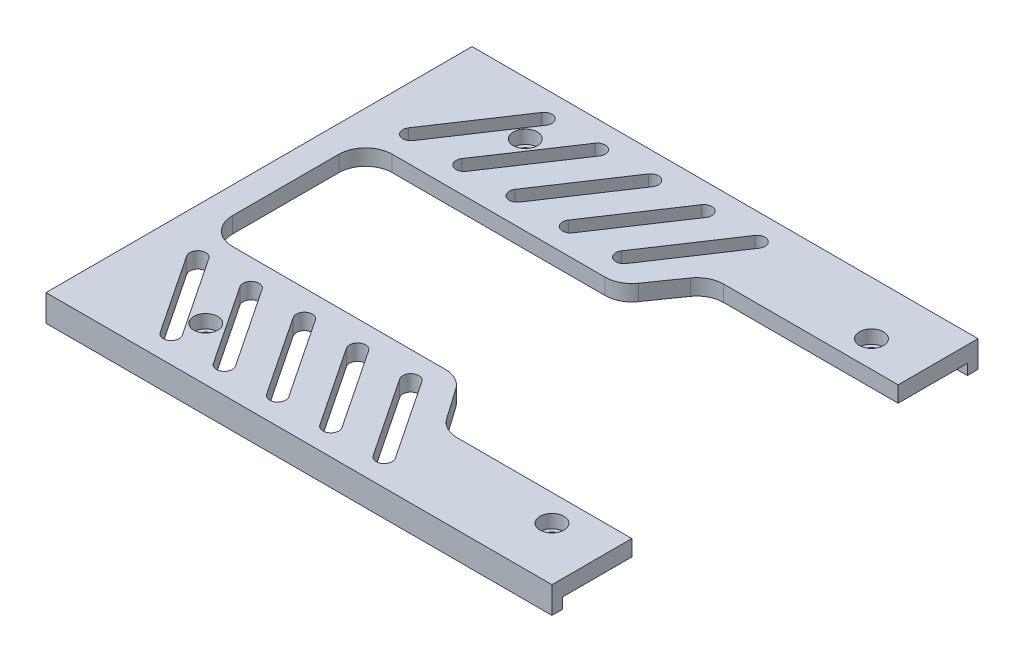
from build123d import *

# Parameters (mm, degrees)
SKETCH1_W           = 190
SKETCH1_H           = 160
BOSS_EXTRUDE1_DEPTH = 6
CUT_EXTRUDE1_DEPTH  = 10
SKETCH3_W           = 185
SKETCH3_H           = 4
SKETCH3_W_2         = 5
SKETCH3_H_2         = 152
BOSS_EXTRUDE3_DEPTH = 4
SKETCH4_R           = 4.5
CUT_EXTRUDE2_DEPTH  = 5
SKETCH5_R           = 3
CUT_EXTRUDE7_DEPTH  = 5


with BuildPart() as part:
    # Sketch1 → Boss-Extrude1 (new body)
    with BuildSketch(Plane(origin=(0, 0, 0), x_dir=(1, 0, 0), z_dir=(0, 1, 0))):
        with Locations((95, 80)):
            Rectangle(SKETCH1_W, SKETCH1_H)
    extrude(amount=BOSS_EXTRUDE1_DEPTH)

    # Sketch2 → Cut-Extrude1 (cut)
    with BuildSketch(Plane(origin=(0, 6, 0), x_dir=(1, 0, 0), z_dir=(0, 1, 0))):
        with BuildLine():
            ThreePointArc((34.503849117, 8.335899411), (38.664100589, 7.503849117), (39.496150883, 11.664100589))
            Line((39.496150883, 11.664100589), (20.605551275, 40))
            Line((20.605551275, 40), (19.496150883, 41.664100589))
            ThreePointArc((19.496150883, 41.664100589), (15.335899411, 42.496150883), (14.503849117, 38.335899411))
            Line((14.503849117, 38.335899411), (34.503849117, 8.335899411))
        make_face()
        with BuildLine():
            Line((10, 100), (10, 60))
            ThreePointArc((10, 60), (12.928932188, 52.928932188), (20, 50))
            Line((20, 50), (100, 50))
            ThreePointArc((100, 50), (104.617486132, 48.870108332), (108.191520443, 45.735764364))
            Line((108.191520443, 45.735764364), (116.223971332, 34.264235636))
            ThreePointArc((116.223971332, 34.264235636), (119.798005643, 31.129891668), (124.415491775, 30))
            Line((124.415491775, 30), (190, 30))
            Line((190, 30), (190, 130))
            Line((190, 130), (124.415491775, 130))
            ThreePointArc((124.415491775, 130), (119.798005643, 128.870108332), (116.223971332, 125.735764364))
            Line((116.223971332, 125.735764364), (108.191520443, 114.264235636))
            ThreePointArc((108.191520443, 114.264235636), (104.617486132, 111.129891668), (100, 110))
            Line((100, 110), (20, 110))
            ThreePointArc((20, 110), (12.928932188, 107.071067812), (10, 100))
        make_face()
        with BuildLine():
            Line((34.503849117, 38.335899411), (54.503849117, 8.335899411))
            ThreePointArc((54.503849117, 8.335899411), (58.664100589, 7.503849117), (59.496150883, 11.664100589))
            Line((59.496150883, 11.664100589), (39.496150883, 41.664100589))
            ThreePointArc((39.496150883, 41.664100589), (35.335899411, 42.496150883), (34.503849117, 38.335899411))
        make_face()
        with BuildLine():
            Line((54.503849117, 38.335899411), (74.503849117, 8.335899411))
            ThreePointArc((74.503849117, 8.335899411), (78.664100589, 7.503849117), (79.496150883, 11.664100589))
            Line((79.496150883, 11.664100589), (59.496150883, 41.664100589))
            ThreePointArc((59.496150883, 41.664100589), (55.335899411, 42.496150883), (54.503849117, 38.335899411))
        make_face()
        with BuildLine():
            Line((74.503849117, 38.335899411), (94.503849117, 8.335899411))
            ThreePointArc((94.503849117, 8.335899411), (98.664100589, 7.503849117), (99.496150883, 11.664100589))
            Line((99.496150883, 11.664100589), (79.496150883, 41.664100589))
            ThreePointArc((79.496150883, 41.664100589), (75.335899411, 42.496150883), (74.503849117, 38.335899411))
        make_face()
        with BuildLine():
            Line((94.503849117, 38.335899411), (113.394448725, 10))
            Line((113.394448725, 10), (114.503849117, 8.335899411))
            ThreePointArc((114.503849117, 8.335899411), (118.664100589, 7.503849117), (119.496150883, 11.664100589))
            Line((119.496150883, 11.664100589), (99.496150883, 41.664100589))
            ThreePointArc((99.496150883, 41.664100589), (96.130647554, 42.871276079), (94, 40))
            ThreePointArc((94, 40), (94.128723921, 39.130647554), (94.503849117, 38.335899411))
        make_face()
        with BuildLine():
            ThreePointArc((94.503849117, 121.664100589), (95.335899411, 117.503849117), (99.496150883, 118.335899411))
            Line((99.496150883, 118.335899411), (119.496150883, 148.335899411))
            ThreePointArc((119.496150883, 148.335899411), (118.664100589, 152.496150883), (114.503849117, 151.664100589))
            Line((114.503849117, 151.664100589), (94.503849117, 121.664100589))
        make_face()
        with BuildLine():
            ThreePointArc((74.503849117, 121.664100589), (75.335899411, 117.503849117), (79.496150883, 118.335899411))
            Line((79.496150883, 118.335899411), (99.496150883, 148.335899411))
            ThreePointArc((99.496150883, 148.335899411), (98.664100589, 152.496150883), (94.503849117, 151.664100589))
            Line((94.503849117, 151.664100589), (74.503849117, 121.664100589))
        make_face()
        with BuildLine():
            ThreePointArc((54.503849117, 121.664100589), (55.335899411, 117.503849117), (59.496150883, 118.335899411))
            Line((59.496150883, 118.335899411), (79.496150883, 148.335899411))
            ThreePointArc((79.496150883, 148.335899411), (78.664100589, 152.496150883), (74.503849117, 151.664100589))
            Line((74.503849117, 151.664100589), (54.503849117, 121.664100589))
        make_face()
        with BuildLine():
            ThreePointArc((34.503849117, 121.664100589), (35.335899411, 117.503849117), (39.496150883, 118.335899411))
            Line((39.496150883, 118.335899411), (59.496150883, 148.335899411))
            ThreePointArc((59.496150883, 148.335899411), (58.664100589, 152.496150883), (54.503849117, 151.664100589))
            Line((54.503849117, 151.664100589), (34.503849117, 121.664100589))
        make_face()
        with BuildLine():
            ThreePointArc((14.503849117, 121.664100589), (15.335899411, 117.503849117), (19.496150883, 118.335899411))
            Line((19.496150883, 118.335899411), (39.496150883, 148.335899411))
            ThreePointArc((39.496150883, 148.335899411), (38.664100589, 152.496150883), (34.503849117, 151.664100589))
            Line((34.503849117, 151.664100589), (14.503849117, 121.664100589))
        make_face()
    extrude(amount=-CUT_EXTRUDE1_DEPTH, mode=Mode.SUBTRACT)

    # Sketch3 → Boss-Extrude3 (add)
    with BuildSketch(Plane.XZ):
        with Locations((97.5, -158)):
            Rectangle(SKETCH3_W, SKETCH3_H)
        with Locations((2.5, -158)):
            Rectangle(SKETCH3_W_2, SKETCH3_H)
        with Locations((2.5, -80)):
            Rectangle(SKETCH3_W_2, SKETCH3_H_2)
        with Locations((97.5, -2)):
            Rectangle(SKETCH3_W, SKETCH3_H)
        with Locations((2.5, -2)):
            Rectangle(SKETCH3_W_2, SKETCH3_H)
    extrude(amount=BOSS_EXTRUDE3_DEPTH)

    # Sketch4 → Cut-Extrude2 (cut)
    with BuildSketch(Plane(origin=(0, 6, 0), x_dir=(1, 0, 0), z_dir=(0, 1, 0))):
        with Locations(Location((170, 140, 0), (0, 0, 270))):
            Circle(SKETCH4_R)
        with Locations(Location((40, 140, 0), (0, 0, 270))):
            Circle(SKETCH4_R)
        with Locations(Location((170, 20, 0), (0, 0, 90))):
            Circle(SKETCH4_R)
        with Locations(Location((40, 20, 0), (0, 0, 90))):
            Circle(SKETCH4_R)
    extrude(amount=-CUT_EXTRUDE2_DEPTH, mode=Mode.SUBTRACT)

    # Sketch5 → Cut-Extrude7 (cut)
    with BuildSketch(Plane(origin=(0, 0, 0), x_dir=(1, 0, 0), z_dir=(0, 1, 0))):
        with Locations(Location((170, 140, 0), (0, 0, 270))):
            Circle(SKETCH5_R)
        with Locations(Location((40, 140, 0), (0, 0, 270))):
            Circle(SKETCH5_R)
        with Locations(Location((170, 20, 0), (0, 0, 90))):
            Circle(SKETCH5_R)
        with Locations(Location((40, 20, 0), (0, 0, 90))):
            Circle(SKETCH5_R)
    extrude(amount=CUT_EXTRUDE7_DEPTH, mode=Mode.SUBTRACT)


solid = part.part
